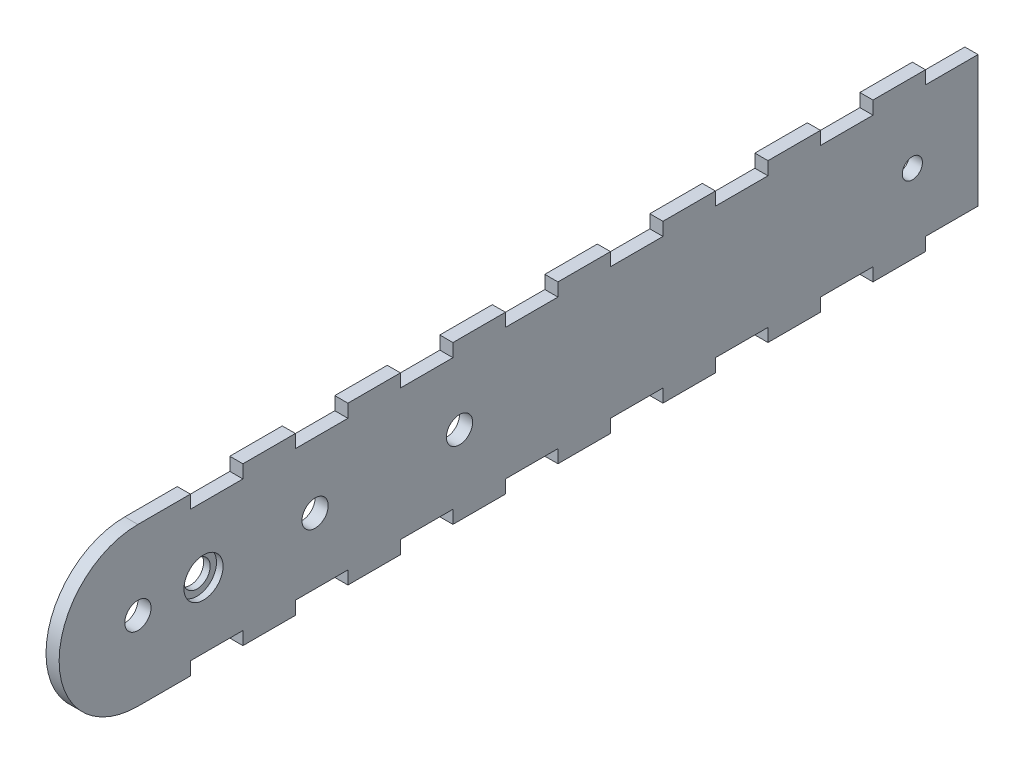
from build123d import *

# Parameters (mm, degrees)
SKETCH1_R           = 3.175
BOSS_EXTRUDE1_DEPTH = 3.175
SKETCH2_R           = 3.2004
SKETCH2_R_2         = 2.4384
SKETCH2_R_3         = 3.175
CUT_EXTRUDE2_DEPTH  = 205.115710138
SKETCH3_R           = 4.73075
CUT_EXTRUDE3_DEPTH  = 1.5875


with BuildPart() as part:
    # Sketch1 → Boss-Extrude1 (new body)
    with BuildSketch(Plane(origin=(0, 0, 0), x_dir=(0, 0, -1), z_dir=(1, 0, 0))):
        with BuildLine():
            Line((12.7, 19.05), (0, 19.05))
            ThreePointArc((0, 19.05), (-19.05, 0), (0, -19.05))
            Line((0, -19.05), (12.7, -19.05))
            Line((12.7, -19.05), (12.7, -15.875))
            Line((12.7, -15.875), (25.4, -15.875))
            Line((25.4, -15.875), (25.4, -19.05))
            Line((25.4, -19.05), (38.1, -19.05))
            Line((38.1, -19.05), (38.1, -15.875))
            Line((38.1, -15.875), (50.8, -15.875))
            Line((50.8, -15.875), (50.8, -19.05))
            Line((50.8, -19.05), (63.5, -19.05))
            Line((63.5, -19.05), (63.5, -15.875))
            Line((63.5, -15.875), (76.2, -15.875))
            Line((76.2, -15.875), (76.2, -19.05))
            Line((76.2, -19.05), (88.9, -19.05))
            Line((88.9, -19.05), (88.9, -15.875))
            Line((88.9, -15.875), (101.6, -15.875))
            Line((101.6, -15.875), (101.6, -19.05))
            Line((101.6, -19.05), (114.3, -19.05))
            Line((114.3, -19.05), (114.3, -15.875))
            Line((114.3, -15.875), (127, -15.875))
            Line((127, -15.875), (127, -19.05))
            Line((127, -19.05), (139.7, -19.05))
            Line((139.7, -19.05), (139.7, -15.875))
            Line((139.7, -15.875), (152.4, -15.875))
            Line((152.4, -15.875), (152.4, -19.05))
            Line((152.4, -19.05), (165.1, -19.05))
            Line((165.1, -19.05), (165.1, -15.875))
            Line((165.1, -15.875), (177.8, -15.875))
            Line((177.8, -15.875), (177.8, -19.05))
            Line((177.8, -19.05), (190.5, -19.05))
            Line((190.5, -19.05), (190.5, -15.875))
            Line((190.5, -15.875), (203.2, -15.875))
            Line((203.2, -15.875), (203.2, 15.875))
            Line((203.2, 15.875), (190.5, 15.875))
            Line((190.5, 15.875), (190.5, 19.05))
            Line((190.5, 19.05), (177.8, 19.05))
            Line((177.8, 19.05), (177.8, 15.875))
            Line((177.8, 15.875), (165.1, 15.875))
            Line((165.1, 15.875), (165.1, 19.05))
            Line((165.1, 19.05), (152.4, 19.05))
            Line((152.4, 19.05), (152.4, 15.875))
            Line((152.4, 15.875), (139.7, 15.875))
            Line((139.7, 15.875), (139.7, 19.05))
            Line((139.7, 19.05), (127, 19.05))
            Line((127, 19.05), (127, 15.875))
            Line((127, 15.875), (114.3, 15.875))
            Line((114.3, 15.875), (114.3, 19.05))
            Line((114.3, 19.05), (101.6, 19.05))
            Line((101.6, 19.05), (101.6, 15.875))
            Line((101.6, 15.875), (88.9, 15.875))
            Line((88.9, 15.875), (88.9, 19.05))
            Line((88.9, 19.05), (76.2, 19.05))
            Line((76.2, 19.05), (76.2, 15.875))
            Line((76.2, 15.875), (63.5, 15.875))
            Line((63.5, 15.875), (63.5, 19.05))
            Line((63.5, 19.05), (50.8, 19.05))
            Line((50.8, 19.05), (50.8, 15.875))
            Line((50.8, 15.875), (38.1, 15.875))
            Line((38.1, 15.875), (38.1, 19.05))
            Line((38.1, 19.05), (25.4, 19.05))
            Line((25.4, 19.05), (25.4, 15.875))
            Line((25.4, 15.875), (12.7, 15.875))
            Line((12.7, 15.875), (12.7, 19.05))
        make_face()
        Circle(SKETCH1_R, mode=Mode.SUBTRACT)
    extrude(amount=BOSS_EXTRUDE1_DEPTH)

    # Sketch2 → Cut-Extrude2 (cut, through all)
    with BuildSketch(Plane(origin=(3.175, 0, 0), x_dir=(0, 0, -1), z_dir=(1, 0, 0))):
        with Locations((15.875, 0)):
            Circle(SKETCH2_R)
        with Locations((187.325, 0)):
            Circle(SKETCH2_R_2)
        with Locations((42.8625, -9.647e-06)):
            Circle(SKETCH2_R_3)
        with Locations((77.7875, 0)):
            Circle(SKETCH2_R_3)
    extrude(amount=-CUT_EXTRUDE2_DEPTH, mode=Mode.SUBTRACT)

    # Sketch3 → Cut-Extrude3 (cut)
    with BuildSketch(Plane(origin=(3.175, 0, 0), x_dir=(0, 0, -1), z_dir=(1, 0, 0))):
        with Locations((15.875, 0)):
            Circle(SKETCH3_R)
    extrude(amount=-CUT_EXTRUDE3_DEPTH, mode=Mode.SUBTRACT)


solid = part.part
